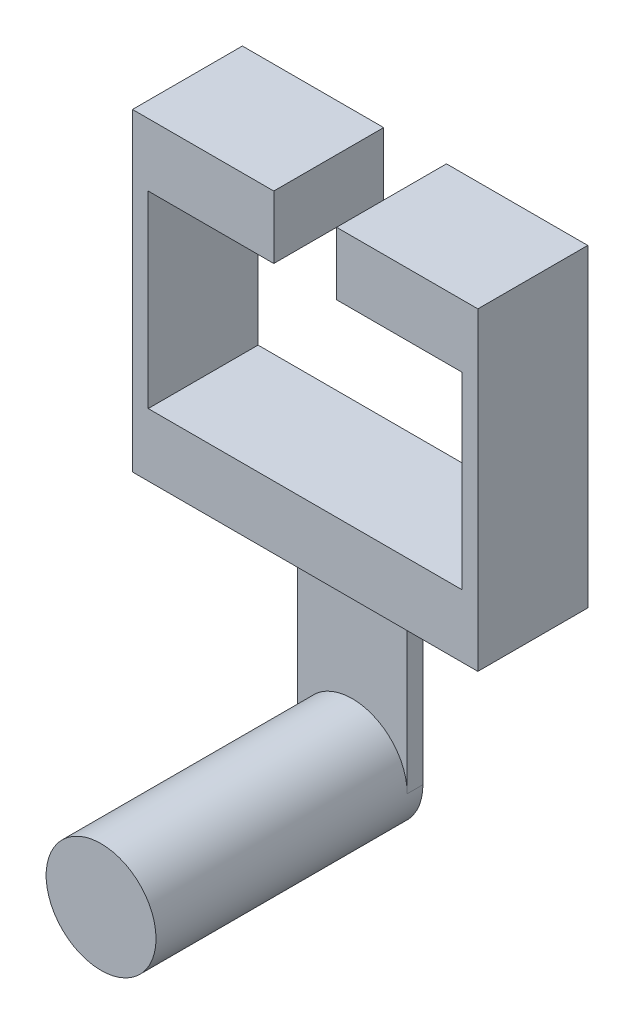
from build123d import *

# Parameters (mm, degrees)
BOSS_EXTRUDE1_DEPTH = 875
SKETCH2_W           = 875
SKETCH2_H           = 125
BOSS_EXTRUDE2_DEPTH = 1500
SKETCH3_R           = 437.5
BOSS_EXTRUDE3_DEPTH = 2000
BOSS_EXTRUDE4_START = 125
BOSS_EXTRUDE4_DEPTH = 125


with BuildPart() as part:
    # Sketch1 → Boss-Extrude1 (new body)
    with BuildSketch(Plane.XY):
        Polygon((171.90508229, 256.485559069), (2921.90508229, 256.485559069), (2921.90508229, 2756.485559069), (1796.90508229, 2756.485559069), (1796.90508229, 2256.485559069), (2796.90508229, 2256.485559069), (2796.90508229, 756.485559069), (296.90508229, 756.485559069), (296.90508229, 2256.485559069), (1296.90508229, 2256.485559069), (1296.90508229, 2756.485559069), (171.90508229, 2756.485559069), align=None)
    extrude(amount=BOSS_EXTRUDE1_DEPTH)

    # Sketch2 → Boss-Extrude2 (add)
    with BuildSketch(Plane(origin=(0, 256.485559069, 0), x_dir=(-1, 0, 0), z_dir=(0, -1, 0))):
        with Locations((-1546.90508229, -437.5)):
            Rectangle(SKETCH2_W, SKETCH2_H)
    extrude(amount=BOSS_EXTRUDE2_DEPTH)

    # Sketch3 → Boss-Extrude3 (add)
    with BuildSketch(Plane.XY.offset(500)):
        with Locations((1546.90508229, -1243.514440931)):
            Circle(SKETCH3_R)
    extrude(amount=BOSS_EXTRUDE3_DEPTH)

    # Sketch4 → Boss-Extrude4 (add)
    with BuildSketch(Plane(origin=(0, 0, 500), x_dir=(-1, 0, 0), z_dir=(0, 0, -1)).offset(BOSS_EXTRUDE4_START)):
        with BuildLine():
            Line((-1984.40508229, -1243.514440931), (-1109.40508229, -1243.514440931))
            ThreePointArc((-1109.40508229, -1243.514440931), (-1546.90508229, -1681.014440931), (-1984.40508229, -1243.514440931))
        make_face()
    extrude(amount=-BOSS_EXTRUDE4_DEPTH)


solid = part.part
